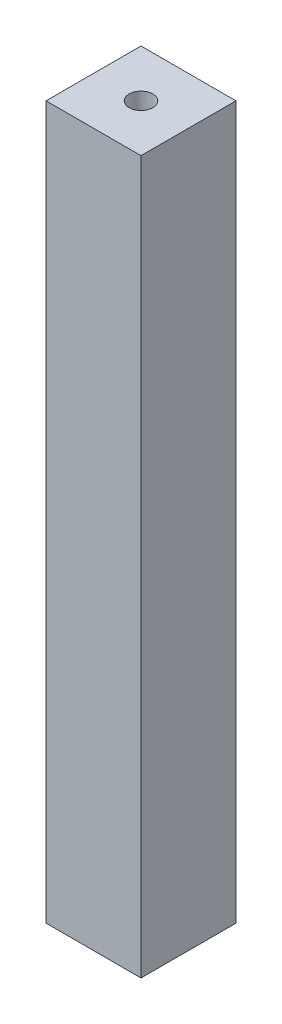
from build123d import *

# Parameters (mm, degrees)
SKETCH1_W           = 20
SKETCH1_H           = 20
BOSS_EXTRUDE1_DEPTH = 150
SKETCH2_R           = 2.5
CUT_EXTRUDE1_DEPTH  = 150


with BuildPart() as part:
    # Sketch1 → Boss-Extrude1 (new body)
    with BuildSketch(Plane(origin=(0, 0, 0), x_dir=(1, 0, 0), z_dir=(0, 1, 0))):
        Rectangle(SKETCH1_W, SKETCH1_H)
    extrude(amount=BOSS_EXTRUDE1_DEPTH)

    # Sketch2 → Cut-Extrude1 (cut)
    with BuildSketch(Plane(origin=(0, 150, 0), x_dir=(1, 0, 0), z_dir=(0, 1, 0))):
        with Locations(Location((0, 0, 0), (0, 0, 270))):
            Circle(SKETCH2_R)
    extrude(amount=-CUT_EXTRUDE1_DEPTH, mode=Mode.SUBTRACT)


solid = part.part
